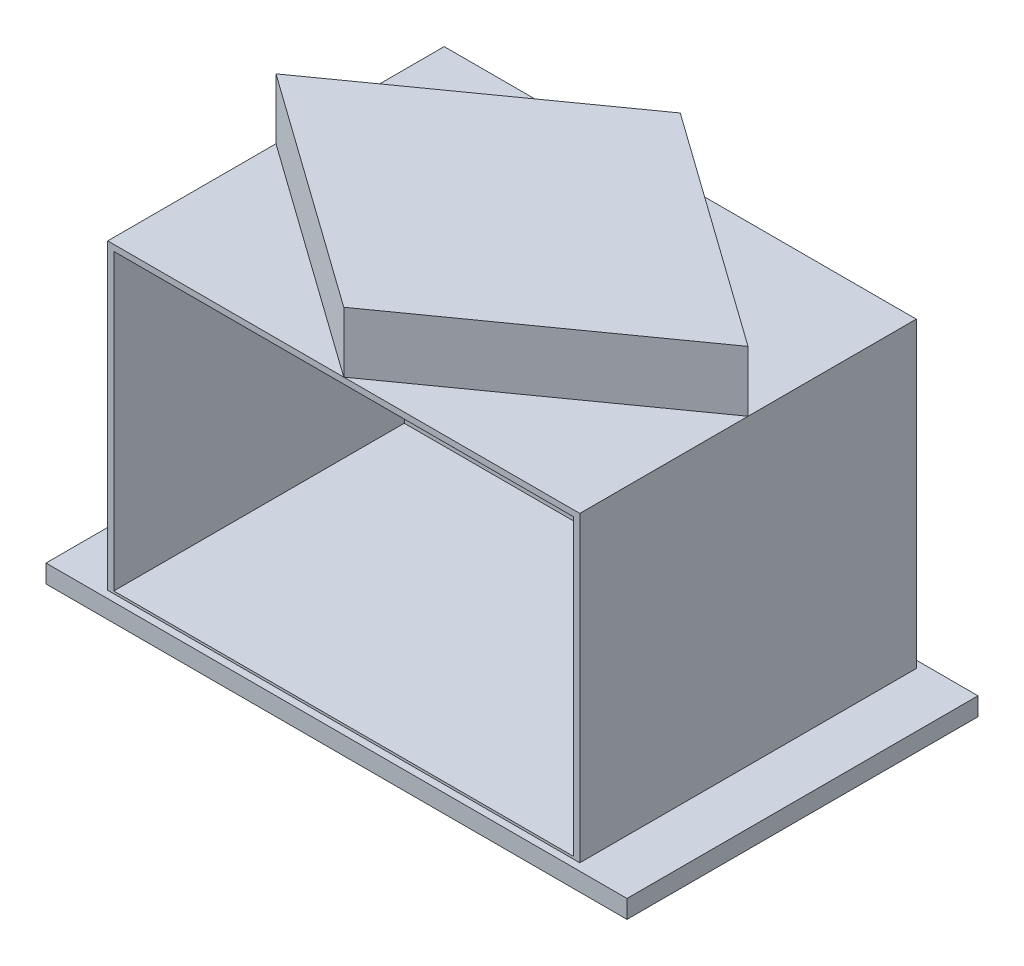
from build123d import *

# Parameters (mm, degrees)
SKETCH_1_W          = 480
SKETCH_1_H          = 290
EXTRUDE_1_DEPTH     = 15
SKETCH_2_W          = 390
SKETCH_2_H          = 178
EXTRUDE_2_DEPTH     = 250
SKETCH_7_W          = 390
SKETCH_7_H          = 250
EXTRUDE_7_DEPTH     = 100
SKETCH_8_W          = 380
SKETCH_8_H          = 243
CUT_EXTRUDE_1_DEPTH = 240
EXTRUDE_8_DEPTH     = 50


with BuildPart() as part:
    # 草图1 → 凸台-拉伸1 (new body)
    with BuildSketch(Plane(origin=(0, 0, 0), x_dir=(1, 0, 0), z_dir=(0, 1, 0))):
        Rectangle(SKETCH_1_W, SKETCH_1_H)
    extrude(amount=-EXTRUDE_1_DEPTH)

    # 草图2 → 凸台-拉伸2 (add)
    with BuildSketch(Plane(origin=(0, 0, 0), x_dir=(1, 0, 0), z_dir=(0, 1, 0))):
        with Locations((0, 50)):
            Rectangle(SKETCH_2_W, SKETCH_2_H)
    extrude(amount=EXTRUDE_2_DEPTH)

    # 草图7 → 凸台-拉伸7 (add)
    with BuildSketch(Plane.XY.offset(39)):
        with Locations((0, 125)):
            Rectangle(SKETCH_7_W, SKETCH_7_H)
    extrude(amount=EXTRUDE_7_DEPTH)

    # 草图8 → 切除-拉伸1 (cut)
    with BuildSketch(Plane.XY.offset(139)):
        with Locations((0, 123.5)):
            Rectangle(SKETCH_8_W, SKETCH_8_H)
    extrude(amount=-CUT_EXTRUDE_1_DEPTH, mode=Mode.SUBTRACT)

    # 草图10 → 凸台-拉伸8 (add)
    with BuildSketch(Plane(origin=(0, 250, 0), x_dir=(1, 0, 0), z_dir=(0, 1, 0))):
        Polygon((0, 139), (-195, 0), (0, -139), (195, 0), align=None)
    extrude(amount=EXTRUDE_8_DEPTH)


solid = part.part
